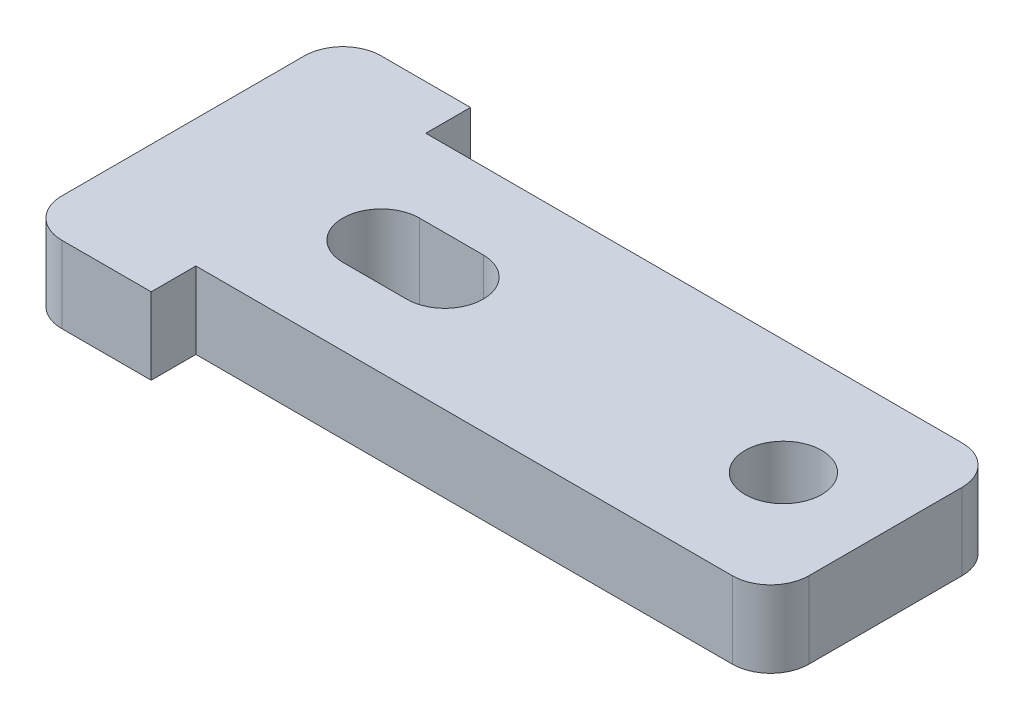
from build123d import *

# Parameters (mm, degrees)
SKETCH_1_R      = 1.5
EXTRUDE_1_DEPTH = 3


with BuildPart() as part:
    # 草图1 → 凸台-拉伸1 (new body)
    with BuildSketch(Plane(origin=(0, 0, 0), x_dir=(1, 0, 0), z_dir=(0, 1, 0))):
        with BuildLine():
            Line((0, 4.75), (0, -4.75))
            ThreePointArc((0, -4.75), (0.439339828, -5.810660172), (1.5, -6.25))
            Line((1.5, -6.25), (5, -6.25))
            Line((5, -6.25), (5, -4.5))
            Line((5, -4.5), (26, -4.5))
            ThreePointArc((26, -4.5), (27.060660172, -4.060660172), (27.5, -3))
            Line((27.5, -3), (27.5, 3))
            ThreePointArc((27.5, 3), (27.060660172, 4.060660172), (26, 4.5))
            Line((26, 4.5), (5, 4.5))
            Line((5, 4.5), (5, 6.25))
            Line((5, 6.25), (1.5, 6.25))
            ThreePointArc((1.5, 6.25), (0.439339828, 5.810660172), (0, 4.75))
        make_face()
        with Locations(Location((23.5, 0, 0), (0, 0, 270))):
            Circle(SKETCH_1_R, mode=Mode.SUBTRACT)
        with BuildLine():
            Line((7.75, 1.5), (10.25, 1.5))
            ThreePointArc((10.25, 1.5), (11.75, 0), (10.25, -1.5))
            Line((10.25, -1.5), (7.75, -1.5))
            ThreePointArc((7.75, -1.5), (6.25, 0), (7.75, 1.5))
        make_face(mode=Mode.SUBTRACT)
    extrude(amount=EXTRUDE_1_DEPTH)


solid = part.part
